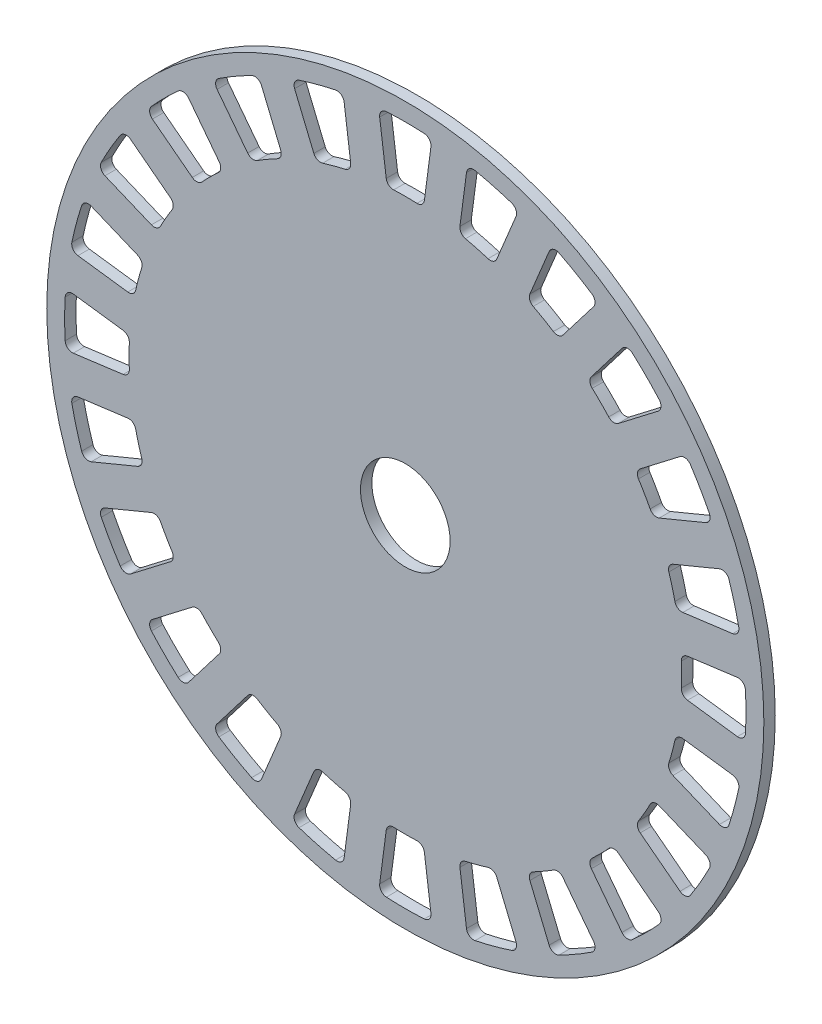
from build123d import *

# Parameters (mm, degrees)
SKETCH1_R                             = 100
SKETCH1_R_2                           = 12.5
PLATE_EXTRUDE_DEPTH                   = 3.175
COIL_MOUNTING_CUT_DEPTH               = 142.456992139
COIL_MOUNTING_FILLET_R                = 2
CIRPATTERN1_COUNT                     = 24
COIL_MOUNTING_FILLET_OF_CIRPATTERN1_R = 2


with BuildPart() as part:
    # Sketch1 → Plate Extrude (new body)
    with BuildSketch(Plane.XY):
        Circle(SKETCH1_R)
        Circle(SKETCH1_R_2, mode=Mode.SUBTRACT)
    extrude(amount=PLATE_EXTRUDE_DEPTH)

    # Sketch2 → Coil Mounting Cut (cut, through all)
    with BuildSketch(Plane.XY.offset(3.175)):
        with BuildLine():
            Line((5.07696651, 76.869877126), (7.42643797, 94.71588463))
            ThreePointArc((7.42643797, 94.71588463), (0, 95.006582836), (-7.42643797, 94.71588463))
            Line((-7.42643797, 94.71588463), (-5.07696651, 76.869877126))
            ThreePointArc((-5.07696651, 76.869877126), (0, 77.037351968), (5.07696651, 76.869877126))
        make_face()
    coil_mounting_cut = extrude(amount=-COIL_MOUNTING_CUT_DEPTH, mode=Mode.SUBTRACT)

    # Coil Mounting Fillet
    coil_mounting_fillet_edges = [part.edges().sort_by_distance(p)[0] for p in [
        (-7.42643797, 94.71588463, 1.5875),
        (7.42643797, 94.71588463, 1.5875),
        (5.07696651, 76.869877126, 1.5875),
        (-5.07696651, 76.869877126, 1.5875),
    ]]
    fillet(coil_mounting_fillet_edges, radius=COIL_MOUNTING_FILLET_R)

    # CirPattern1: Coil Mounting Cut ×24 about axis
    cirpattern1_axis = Axis((0, 0, 0), (0, 0, 1))
    for i in range(1, CIRPATTERN1_COUNT):
        add(coil_mounting_cut.rotate(cirpattern1_axis, i * 360 / CIRPATTERN1_COUNT), mode=Mode.SUBTRACT)

    # Coil Mounting Fillet of CirPattern1
    coil_mounting_fillet_of_cirpattern1_edges = [part.edges().sort_by_distance(p)[0] for p in [
        (-31.687663049, 89.56641554, 1.5875),
        (-17.340886584, 93.410622708, 1.5875),
        (-14.991415124, 75.564615203, 1.5875),
        (-24.799361266, 72.936583955, 1.5875),
        (-53.789426257, 78.313143247, 1.5875),
        (-40.926458374, 85.739581217, 1.5875),
        (-34.038156591, 69.109749632, 1.5875),
        (-42.831720535, 64.032783122, 1.5875),
        (-72.225528957, 61.72295966, 1.5875),
        (-61.72295966, 72.225528957, 1.5875),
        (-50.765253937, 57.945168832, 1.5875),
        (-57.945168832, 50.765253937, 1.5875),
        (-85.739581217, 40.926458374, 1.5875),
        (-78.313143247, 53.789426257, 1.5875),
        (-64.032783122, 42.831720535, 1.5875),
        (-69.109749632, 34.038156591, 1.5875),
        (-93.410622708, 17.340886584, 1.5875),
        (-89.56641554, 31.687663049, 1.5875),
        (-72.936583955, 24.799361266, 1.5875),
        (-75.564615203, 14.991415124, 1.5875),
        (-94.71588463, -7.42643797, 1.5875),
        (-94.71588463, 7.42643797, 1.5875),
        (-76.869877126, 5.07696651, 1.5875),
        (-76.869877126, -5.07696651, 1.5875),
        (-89.56641554, -31.687663049, 1.5875),
        (-93.410622708, -17.340886584, 1.5875),
        (-75.564615203, -14.991415124, 1.5875),
        (-72.936583955, -24.799361266, 1.5875),
        (-78.313143247, -53.789426257, 1.5875),
        (-85.739581217, -40.926458374, 1.5875),
        (-69.109749632, -34.038156591, 1.5875),
        (-64.032783122, -42.831720535, 1.5875),
        (-61.72295966, -72.225528957, 1.5875),
        (-72.225528957, -61.72295966, 1.5875),
        (-57.945168832, -50.765253937, 1.5875),
        (-50.765253937, -57.945168832, 1.5875),
        (-40.926458374, -85.739581217, 1.5875),
        (-53.789426257, -78.313143247, 1.5875),
        (-42.831720535, -64.032783122, 1.5875),
        (-34.038156591, -69.109749632, 1.5875),
        (-17.340886584, -93.410622708, 1.5875),
        (-31.687663049, -89.56641554, 1.5875),
        (-24.799361266, -72.936583955, 1.5875),
        (-14.991415124, -75.564615203, 1.5875),
        (7.42643797, -94.71588463, 1.5875),
        (-7.42643797, -94.71588463, 1.5875),
        (-5.07696651, -76.869877126, 1.5875),
        (5.07696651, -76.869877126, 1.5875),
        (31.687663049, -89.56641554, 1.5875),
        (17.340886584, -93.410622708, 1.5875),
        (14.991415124, -75.564615203, 1.5875),
        (24.799361266, -72.936583955, 1.5875),
        (53.789426257, -78.313143247, 1.5875),
        (40.926458374, -85.739581217, 1.5875),
        (34.038156591, -69.109749632, 1.5875),
        (42.831720535, -64.032783122, 1.5875),
        (72.225528957, -61.72295966, 1.5875),
        (61.72295966, -72.225528957, 1.5875),
        (50.765253937, -57.945168832, 1.5875),
        (57.945168832, -50.765253937, 1.5875),
        (85.739581217, -40.926458374, 1.5875),
        (78.313143247, -53.789426257, 1.5875),
        (64.032783122, -42.831720535, 1.5875),
        (69.109749632, -34.038156591, 1.5875),
        (93.410622708, -17.340886584, 1.5875),
        (89.56641554, -31.687663049, 1.5875),
        (72.936583955, -24.799361266, 1.5875),
        (75.564615203, -14.991415124, 1.5875),
        (94.71588463, 7.42643797, 1.5875),
        (94.71588463, -7.42643797, 1.5875),
        (76.869877126, -5.07696651, 1.5875),
        (76.869877126, 5.07696651, 1.5875),
        (89.56641554, 31.687663049, 1.5875),
        (93.410622708, 17.340886584, 1.5875),
        (75.564615203, 14.991415124, 1.5875),
        (72.936583955, 24.799361266, 1.5875),
        (78.313143247, 53.789426257, 1.5875),
        (85.739581217, 40.926458374, 1.5875),
        (69.109749632, 34.038156591, 1.5875),
        (64.032783122, 42.831720535, 1.5875),
        (61.72295966, 72.225528957, 1.5875),
        (72.225528957, 61.72295966, 1.5875),
        (57.945168832, 50.765253937, 1.5875),
        (50.765253937, 57.945168832, 1.5875),
        (40.926458374, 85.739581217, 1.5875),
        (53.789426257, 78.313143247, 1.5875),
        (42.831720535, 64.032783122, 1.5875),
        (34.038156591, 69.109749632, 1.5875),
        (17.340886584, 93.410622708, 1.5875),
        (31.687663049, 89.56641554, 1.5875),
        (24.799361266, 72.936583955, 1.5875),
        (14.991415124, 75.564615203, 1.5875),
    ]]
    fillet(coil_mounting_fillet_of_cirpattern1_edges, radius=COIL_MOUNTING_FILLET_OF_CIRPATTERN1_R)


solid = part.part
